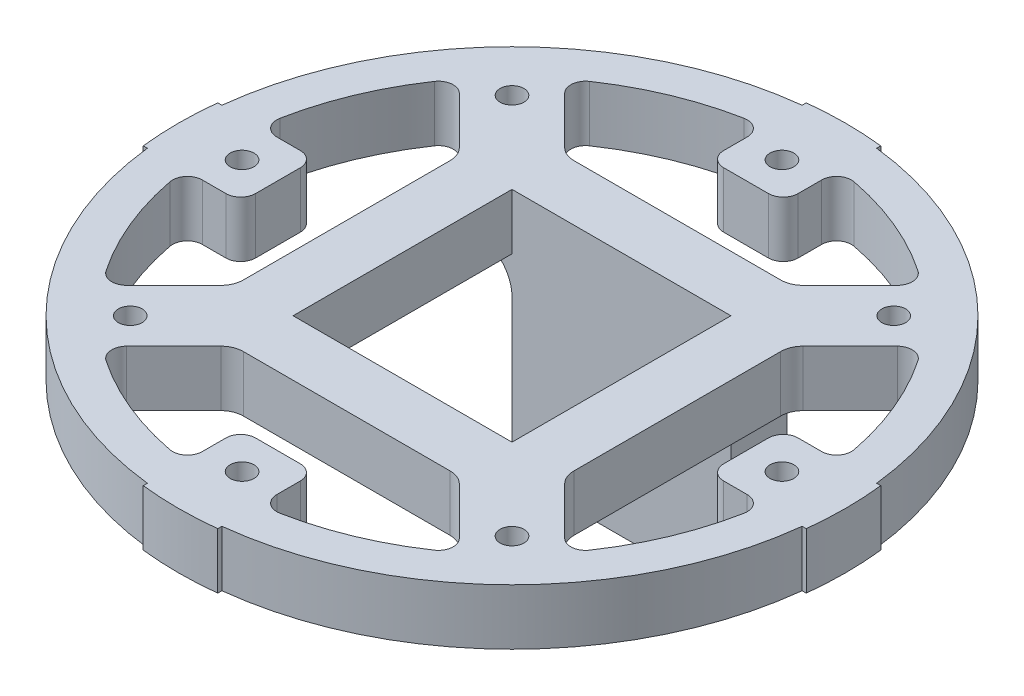
from build123d import *

# Parameters (mm, degrees)
SKETCH1_R           = 1.6
BOSS_EXTRUDE1_DEPTH = 7.5
SKETCH2_W           = 29.4
SKETCH2_H           = 29.4
BOSS_EXTRUDE2_DEPTH = 7.5
SKETCH3_W           = 29.4
SKETCH3_H           = 31
SKETCH3_R           = 1.6
BOSS_EXTRUDE3_DEPTH = 7.5
FILLET1_R           = 5
FILLET2_R           = 2


with BuildPart() as part:
    # Sketch1 → Boss-Extrude1 (new body)
    with BuildSketch(Plane(origin=(0, 0, 0), x_dir=(1, 0, 0), z_dir=(0, 1, 0))):
        with BuildLine():
            Line((-5, 43.966606646), (-5, 44.520107817))
            ThreePointArc((-5, 44.520107817), (0, 44.8), (5, 44.520107817))
            Line((5, 44.520107817), (5, 43.966606646))
            ThreePointArc((5, 43.966606646), (31.289475068, 31.289475068), (43.966606646, 5))
            Line((43.966606646, 5), (44.520107817, 5))
            ThreePointArc((44.520107817, 5), (44.8, 0), (44.520107817, -5))
            Line((44.520107817, -5), (43.966606646, -5))
            ThreePointArc((43.966606646, -5), (31.289475068, -31.289475068), (5, -43.966606646))
            Line((5, -43.966606646), (5, -44.520107817))
            ThreePointArc((5, -44.520107817), (0, -44.8), (-5, -44.520107817))
            Line((-5, -44.520107817), (-5, -43.966606646))
            ThreePointArc((-5, -43.966606646), (-31.289475068, -31.289475068), (-43.966606646, -5))
            Line((-43.966606646, -5), (-44.520107817, -5))
            ThreePointArc((-44.520107817, -5), (-44.8, 0), (-44.520107817, 5))
            Line((-44.520107817, 5), (-43.966606646, 5))
            ThreePointArc((-43.966606646, 5), (-31.289475068, 31.289475068), (-5, 43.966606646))
        make_face()
        with Locations(Location((36.25, 0, 0), (0, 0, 270))):
            Circle(SKETCH1_R, mode=Mode.SUBTRACT)
        with Locations(Location((25.632620818, -25.632620818, 0), (0, 0, 270))):
            Circle(SKETCH1_R, mode=Mode.SUBTRACT)
        with Locations(Location((0, -36.25, 0), (0, 0, 270))):
            Circle(SKETCH1_R, mode=Mode.SUBTRACT)
        with Locations(Location((-25.632620818, -25.632620818, 0), (0, 0, 270))):
            Circle(SKETCH1_R, mode=Mode.SUBTRACT)
        with Locations(Location((-36.25, 0, 0), (0, 0, 270))):
            Circle(SKETCH1_R, mode=Mode.SUBTRACT)
        with Locations(Location((-25.632620818, 25.632620818, 0), (0, 0, 270))):
            Circle(SKETCH1_R, mode=Mode.SUBTRACT)
        with Locations(Location((0, 36.25, 0), (0, 0, 270))):
            Circle(SKETCH1_R, mode=Mode.SUBTRACT)
        with Locations(Location((25.632620818, 25.632620818, 0), (0, 0, 270))):
            Circle(SKETCH1_R, mode=Mode.SUBTRACT)
        with BuildLine():
            Line((33.430226046, 5), (36.586370413, 5))
            ThreePointArc((36.586370413, 5), (38.127746073, 5.725574218), (38.550739294, 7.375838926))
            ThreePointArc((38.550739294, 7.375838926), (36.262271651, 15.02032472), (32.474994896, 22.043983453))
            ThreePointArc((32.474994896, 22.043983453), (31.008980156, 22.911795444), (29.406004524, 22.334936712))
            Line((29.406004524, 22.334936712), (25.760059877, 18.688992065))
            Line((25.760059877, 18.688992065), (18.688992065, 25.760059877))
            Line((18.688992065, 25.760059877), (22.334936712, 29.406004524))
            ThreePointArc((22.334936712, 29.406004524), (22.911795444, 31.008980156), (22.043983453, 32.474994896))
            ThreePointArc((22.043983453, 32.474994896), (15.02032472, 36.262271651), (7.375838926, 38.550739294))
            ThreePointArc((7.375838926, 38.550739294), (5.725574218, 38.127746073), (5, 36.586370413))
            Line((5, 36.586370413), (5, 33.430226046))
            ThreePointArc((5, 33.430226046), (4.414213562, 32.016012484), (3, 31.430226046))
            Line((3, 31.430226046), (-3, 31.430226046))
            ThreePointArc((-3, 31.430226046), (-4.414213562, 32.016012484), (-5, 33.430226046))
            Line((-5, 33.430226046), (-5, 36.586370413))
            ThreePointArc((-5, 36.586370413), (-5.725574218, 38.127746073), (-7.375838926, 38.550739294))
            ThreePointArc((-7.375838926, 38.550739294), (-15.02032472, 36.262271651), (-22.043983453, 32.474994896))
            ThreePointArc((-22.043983453, 32.474994896), (-22.911795444, 31.008980156), (-22.334936712, 29.406004524))
            Line((-22.334936712, 29.406004524), (-18.688992065, 25.760059877))
            Line((-18.688992065, 25.760059877), (-25.760059877, 18.688992065))
            Line((-25.760059877, 18.688992065), (-29.406004524, 22.334936712))
            ThreePointArc((-29.406004524, 22.334936712), (-31.008980156, 22.911795444), (-32.474994896, 22.043983453))
            ThreePointArc((-32.474994896, 22.043983453), (-36.262271651, 15.02032472), (-38.550739294, 7.375838926))
            ThreePointArc((-38.550739294, 7.375838926), (-38.127746073, 5.725574218), (-36.586370413, 5))
            Line((-36.586370413, 5), (-33.430226046, 5))
            ThreePointArc((-33.430226046, 5), (-32.016012484, 4.414213562), (-31.430226046, 3))
            Line((-31.430226046, 3), (-31.430226046, -3))
            ThreePointArc((-31.430226046, -3), (-32.016012484, -4.414213562), (-33.430226046, -5))
            Line((-33.430226046, -5), (-36.586370413, -5))
            ThreePointArc((-36.586370413, -5), (-38.127746073, -5.725574218), (-38.550739294, -7.375838926))
            ThreePointArc((-38.550739294, -7.375838926), (-36.262271651, -15.02032472), (-32.474994896, -22.043983453))
            ThreePointArc((-32.474994896, -22.043983453), (-31.008980156, -22.911795444), (-29.406004524, -22.334936712))
            Line((-29.406004524, -22.334936712), (-25.760059877, -18.688992065))
            Line((-25.760059877, -18.688992065), (-18.688992065, -25.760059877))
            Line((-18.688992065, -25.760059877), (-22.334936712, -29.406004524))
            ThreePointArc((-22.334936712, -29.406004524), (-22.911795444, -31.008980156), (-22.043983453, -32.474994896))
            ThreePointArc((-22.043983453, -32.474994896), (-15.02032472, -36.262271651), (-7.375838926, -38.550739294))
            ThreePointArc((-7.375838926, -38.550739294), (-5.725574218, -38.127746073), (-5, -36.586370413))
            Line((-5, -36.586370413), (-5, -33.430226046))
            ThreePointArc((-5, -33.430226046), (-4.414213562, -32.016012484), (-3, -31.430226046))
            Line((-3, -31.430226046), (3, -31.430226046))
            ThreePointArc((3, -31.430226046), (4.414213562, -32.016012484), (5, -33.430226046))
            Line((5, -33.430226046), (5, -36.586370413))
            ThreePointArc((5, -36.586370413), (5.725574218, -38.127746073), (7.375838926, -38.550739294))
            ThreePointArc((7.375838926, -38.550739294), (15.02032472, -36.262271651), (22.043983453, -32.474994896))
            ThreePointArc((22.043983453, -32.474994896), (22.911795444, -31.008980156), (22.334936712, -29.406004524))
            Line((22.334936712, -29.406004524), (18.688992065, -25.760059877))
            Line((18.688992065, -25.760059877), (25.760059877, -18.688992065))
            Line((25.760059877, -18.688992065), (29.406004524, -22.334936712))
            ThreePointArc((29.406004524, -22.334936712), (31.008980156, -22.911795444), (32.474994896, -22.043983453))
            ThreePointArc((32.474994896, -22.043983453), (36.262271651, -15.02032472), (38.550739294, -7.375838926))
            ThreePointArc((38.550739294, -7.375838926), (38.127746073, -5.725574218), (36.586370413, -5))
            Line((36.586370413, -5), (33.430226046, -5))
            ThreePointArc((33.430226046, -5), (32.016012484, -4.414213562), (31.430226046, -3))
            Line((31.430226046, -3), (31.430226046, 3))
            ThreePointArc((31.430226046, 3), (32.016012484, 4.414213562), (33.430226046, 5))
        make_face(mode=Mode.SUBTRACT)
    extrude(amount=BOSS_EXTRUDE1_DEPTH)

    # Sketch2 → Boss-Extrude2 (add)
    with BuildSketch(Plane(origin=(0, 7.5, 0), x_dir=(1, 0, 0), z_dir=(0, 1, 0))):
        with BuildLine():
            Line((13.886291501, 22.2), (-13.886291501, 22.2))
            ThreePointArc((-13.886291501, 22.2), (-15.034341798, 22.428361402), (-16.007611845, 23.078679656))
            Line((-16.007611845, 23.078679656), (-18.688992065, 25.760059877))
            Line((-18.688992065, 25.760059877), (-25.760059877, 18.688992065))
            Line((-25.760059877, 18.688992065), (-23.078679656, 16.007611845))
            ThreePointArc((-23.078679656, 16.007611845), (-22.428361402, 15.034341798), (-22.2, 13.886291501))
            Line((-22.2, 13.886291501), (-22.2, -13.886291501))
            ThreePointArc((-22.2, -13.886291501), (-22.428361402, -15.034341798), (-23.078679656, -16.007611845))
            Line((-23.078679656, -16.007611845), (-25.760059877, -18.688992065))
            Line((-25.760059877, -18.688992065), (-18.688992065, -25.760059877))
            Line((-18.688992065, -25.760059877), (-16.007611845, -23.078679656))
            ThreePointArc((-16.007611845, -23.078679656), (-15.034341798, -22.428361402), (-13.886291501, -22.2))
            Line((-13.886291501, -22.2), (13.886291501, -22.2))
            ThreePointArc((13.886291501, -22.2), (15.034341798, -22.428361402), (16.007611845, -23.078679656))
            Line((16.007611845, -23.078679656), (18.688992065, -25.760059877))
            Line((18.688992065, -25.760059877), (25.760059877, -18.688992065))
            Line((25.760059877, -18.688992065), (23.078679656, -16.007611845))
            ThreePointArc((23.078679656, -16.007611845), (22.428361402, -15.034341798), (22.2, -13.886291501))
            Line((22.2, -13.886291501), (22.2, 13.886291501))
            ThreePointArc((22.2, 13.886291501), (22.428361402, 15.034341798), (23.078679656, 16.007611845))
            Line((23.078679656, 16.007611845), (25.760059877, 18.688992065))
            Line((25.760059877, 18.688992065), (18.688992065, 25.760059877))
            Line((18.688992065, 25.760059877), (16.007611845, 23.078679656))
            ThreePointArc((16.007611845, 23.078679656), (15.034341798, 22.428361402), (13.886291501, 22.2))
        make_face()
        Rectangle(SKETCH2_W, SKETCH2_H, mode=Mode.SUBTRACT)
    extrude(amount=-BOSS_EXTRUDE2_DEPTH)

    # Sketch3 → Boss-Extrude3 (add)
    with BuildSketch(Plane.XY.offset(-14.7)):
        with Locations((0, -10)):
            Rectangle(SKETCH3_W, SKETCH3_H)
        with Locations((-12, -21.5)):
            Circle(SKETCH3_R, mode=Mode.SUBTRACT)
        with Locations(Location((12, -21.5, 0), (0, 0, 180))):
            Circle(SKETCH3_R, mode=Mode.SUBTRACT)
    extrude(amount=-BOSS_EXTRUDE3_DEPTH)

    # Fillet1
    fillet1_edges = [part.edges().sort_by_distance(p)[0] for p in [
        (-14.7, 0, -18.45),
        (14.7, 0, -18.45),
    ]]
    fillet(fillet1_edges, radius=FILLET1_R)

    # Fillet2
    fillet2_edges = [part.edges().sort_by_distance(p)[0] for p in [
        (-14.7, -25.5, -18.45),
        (14.7, -25.5, -18.45),
    ]]
    fillet(fillet2_edges, radius=FILLET2_R)


solid = part.part
